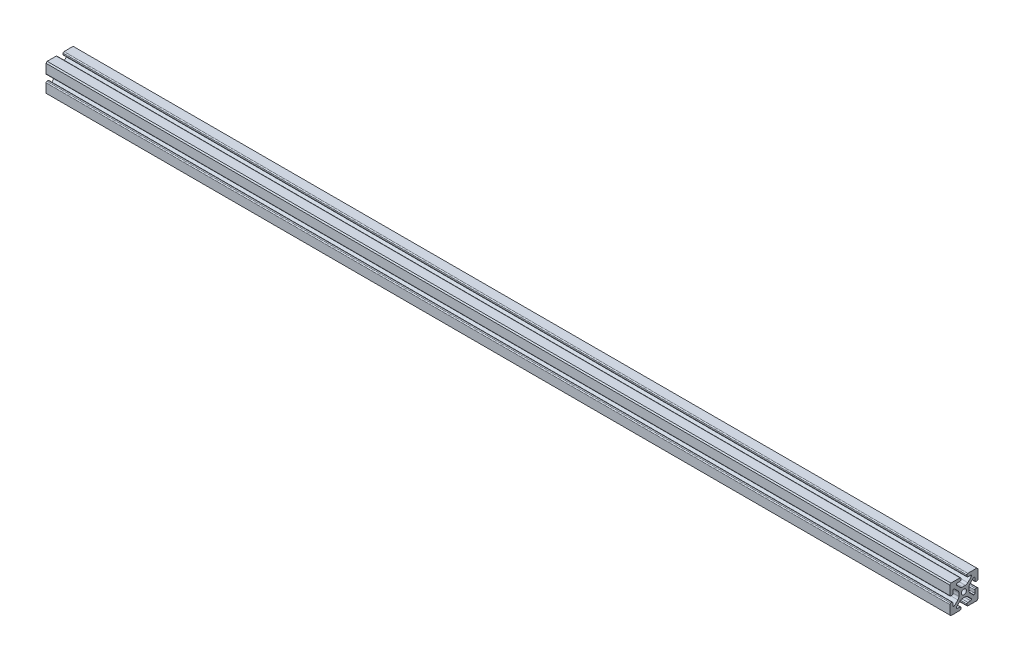
from build123d import *

# Parameters (mm, degrees)
SKETCH1_R           = 3.4036
BOSS_EXTRUDE1_DEPTH = 1219.2


with BuildPart() as part:
    # Sketch1 → Boss-Extrude1 (new body)
    with BuildSketch(Plane(origin=(0, 0, 0), x_dir=(0, -1, 0), z_dir=(-1, 0, 0))):
        with BuildLine():
            Line((19.05, 5.333992226), (19.05, 17.526))
            Line((19.05, 17.526), (17.526, 19.05))
            Line((17.526, 19.05), (5.333991729, 19.05))
            ThreePointArc((5.333991729, 19.05), (4.435966117, 18.678025612), (4.063991729, 17.78))
            Line((4.063991729, 17.78), (4.063991729, 16.12658277))
            ThreePointArc((4.063991729, 16.12658277), (4.435966117, 15.228557158), (5.333991729, 14.85658277))
            Line((5.333991729, 14.85658277), (9.096353874, 14.85658277))
            ThreePointArc((9.096353874, 14.85658277), (9.938252886, 14.507856781), (10.286978874, 13.66595777))
            Line((10.286978874, 13.66595777), (10.286978874, 13.653830065))
            ThreePointArc((10.286978874, 13.653830065), (10.196347959, 13.198197641), (9.938252944, 12.811931112))
            Line((9.938252944, 12.811931112), (5.277611896, 8.151289413))
            ThreePointArc((5.277611896, 8.151289413), (3.732545616, 7.118909013), (1.910015615, 6.756385223))
            Line((1.910015615, 6.756385223), (-1.910018596, 6.756385223))
            ThreePointArc((-1.910018596, 6.756385223), (-3.732548289, 7.118908885), (-5.277614406, 8.151288942))
            Line((-5.277614406, 8.151288942), (-9.93825393, 12.811927815))
            ThreePointArc((-9.93825393, 12.811927815), (-10.19634903, 13.198194385), (-10.286979978, 13.653826886))
            Line((-10.286979978, 13.653826886), (-10.286979978, 13.66595777))
            ThreePointArc((-10.286979978, 13.66595777), (-9.938253989, 14.507856781), (-9.096354978, 14.85658277))
            Line((-9.096354978, 14.85658277), (-5.333992226, 14.85658277))
            ThreePointArc((-5.333992226, 14.85658277), (-4.435966614, 15.228557158), (-4.063992226, 16.12658277))
            Line((-4.063992226, 16.12658277), (-4.063992226, 17.78))
            ThreePointArc((-4.063992226, 17.78), (-4.435966614, 18.678025612), (-5.333992226, 19.05))
            Line((-5.333992226, 19.05), (-17.526, 19.05))
            Line((-17.526, 19.05), (-19.05, 17.526))
            Line((-19.05, 17.526), (-19.05, 5.333992226))
            ThreePointArc((-19.05, 5.333992226), (-18.678025612, 4.435966614), (-17.78, 4.063992226))
            Line((-17.78, 4.063992226), (-16.12658277, 4.063992226))
            ThreePointArc((-16.12658277, 4.063992226), (-15.228557158, 4.435966614), (-14.85658277, 5.333992226))
            Line((-14.85658277, 5.333992226), (-14.85658277, 9.096354978))
            ThreePointArc((-14.85658277, 9.096354978), (-14.507856781, 9.938253989), (-13.66595777, 10.286979978))
            Line((-13.66595777, 10.286979978), (-13.653827218, 10.286979978))
            ThreePointArc((-13.653827218, 10.286979978), (-13.198194795, 10.196349062), (-12.811928266, 9.938254048))
            Line((-12.811928266, 9.938254048), (-8.151289413, 5.277615846))
            ThreePointArc((-8.151289413, 5.277615846), (-7.118909013, 3.732549566), (-6.756385223, 1.910019566))
            Line((-6.756385223, 1.910019566), (-6.756385223, -1.910017492))
            ThreePointArc((-6.756385223, -1.910017492), (-7.118908885, -3.732547185), (-8.151288942, -5.277613302))
            Line((-8.151288942, -5.277613302), (-12.811927815, -9.938252827))
            ThreePointArc((-12.811927815, -9.938252827), (-13.198194385, -10.196347927), (-13.653826886, -10.286978874))
            Line((-13.653826886, -10.286978874), (-13.66595777, -10.286978874))
            ThreePointArc((-13.66595777, -10.286978874), (-14.507856781, -9.938252886), (-14.85658277, -9.096353874))
            Line((-14.85658277, -9.096353874), (-14.85658277, -5.333991729))
            ThreePointArc((-14.85658277, -5.333991729), (-15.228557158, -4.435966117), (-16.12658277, -4.063991729))
            Line((-16.12658277, -4.063991729), (-17.78, -4.063991729))
            ThreePointArc((-17.78, -4.063991729), (-18.678025612, -4.435966117), (-19.05, -5.333991729))
            Line((-19.05, -5.333991729), (-19.05, -17.526))
            Line((-19.05, -17.526), (-17.526, -19.05))
            Line((-17.526, -19.05), (-5.333992226, -19.05))
            ThreePointArc((-5.333992226, -19.05), (-4.435966614, -18.678025612), (-4.063992226, -17.78))
            Line((-4.063992226, -17.78), (-4.063992226, -16.126583724))
            ThreePointArc((-4.063992226, -16.126583724), (-4.435966614, -15.228558112), (-5.333992226, -14.856583724))
            Line((-5.333992226, -14.856583724), (-9.096354978, -14.856583724))
            ThreePointArc((-9.096354978, -14.856583724), (-9.938253989, -14.507857736), (-10.286979978, -13.665958724))
            Line((-10.286979978, -13.665958724), (-10.286979978, -13.653828173))
            ThreePointArc((-10.286979978, -13.653828173), (-10.196349062, -13.198195749), (-9.938254048, -12.81192922))
            Line((-9.938254048, -12.81192922), (-5.277615159, -8.15128968))
            ThreePointArc((-5.277615159, -8.15128968), (-3.732548878, -7.11890928), (-1.910018878, -6.75638549))
            Line((-1.910018878, -6.75638549), (1.910021709, -6.75638549))
            ThreePointArc((1.910021709, -6.75638549), (3.732551402, -7.118909152), (5.277617519, -8.151289209))
            Line((5.277617519, -8.151289209), (9.938252827, -12.811923865))
            ThreePointArc((9.938252827, -12.811923865), (10.196347927, -13.198190435), (10.286978874, -13.653822935))
            Line((10.286978874, -13.653822935), (10.286978874, -13.665958724))
            ThreePointArc((10.286978874, -13.665958724), (9.938252886, -14.507857736), (9.096353874, -14.856583724))
            Line((9.096353874, -14.856583724), (5.333991729, -14.856583724))
            ThreePointArc((5.333991729, -14.856583724), (4.435966117, -15.228558112), (4.063991729, -16.126583724))
            Line((4.063991729, -16.126583724), (4.063991729, -17.78))
            ThreePointArc((4.063991729, -17.78), (4.435966117, -18.678025612), (5.333991729, -19.05))
            Line((5.333991729, -19.05), (17.526, -19.05))
            Line((17.526, -19.05), (19.05, -17.526))
            Line((19.05, -17.526), (19.05, -5.333991729))
            ThreePointArc((19.05, -5.333991729), (18.678025612, -4.435966117), (17.78, -4.063991729))
            Line((17.78, -4.063991729), (16.126583724, -4.063991729))
            ThreePointArc((16.126583724, -4.063991729), (15.228558112, -4.435966117), (14.856583724, -5.333991729))
            Line((14.856583724, -5.333991729), (14.856583724, -9.096353874))
            ThreePointArc((14.856583724, -9.096353874), (14.507857736, -9.938252886), (13.665958724, -10.286978874))
            Line((13.665958724, -10.286978874), (13.653828961, -10.286978874))
            ThreePointArc((13.653828961, -10.286978874), (13.198196538, -10.196347959), (12.811930009, -9.938252944))
            Line((12.811930009, -9.938252944), (8.151290074, -5.277613661))
            ThreePointArc((8.151290074, -5.277613661), (7.118909674, -3.732547381), (6.756385884, -1.91001738))
            Line((6.756385884, -1.91001738), (6.756385884, 1.910021149))
            ThreePointArc((6.756385884, 1.910021149), (7.118909547, 3.732550842), (8.151289603, 5.277616959))
            Line((8.151289603, 5.277616959), (12.811925923, 9.93825393))
            ThreePointArc((12.811925923, 9.93825393), (13.198192493, 10.19634903), (13.653824993, 10.286979978))
            Line((13.653824993, 10.286979978), (13.665958724, 10.286979978))
            ThreePointArc((13.665958724, 10.286979978), (14.507857736, 9.938253989), (14.856583724, 9.096354978))
            Line((14.856583724, 9.096354978), (14.856583724, 5.333992226))
            ThreePointArc((14.856583724, 5.333992226), (15.228558112, 4.435966614), (16.126583724, 4.063992226))
            Line((16.126583724, 4.063992226), (17.78, 4.063992226))
            ThreePointArc((17.78, 4.063992226), (18.678025612, 4.435966614), (19.05, 5.333992226))
        make_face()
        with Locations(Location((0, 0, 0), (0, 0, 90))):
            Circle(SKETCH1_R, mode=Mode.SUBTRACT)
    extrude(amount=-BOSS_EXTRUDE1_DEPTH)


solid = part.part
